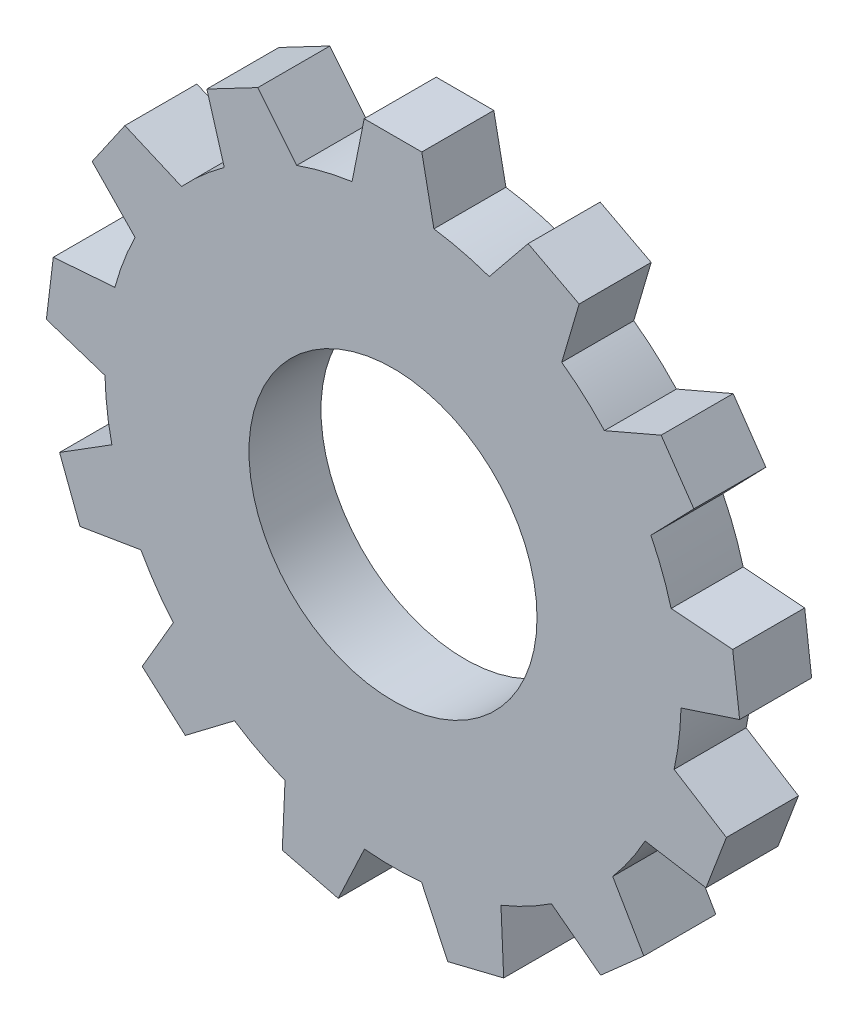
from build123d import *

# Parameters (mm, degrees)
SKETCH1_R           = 12.7
SKETCH1_R_2         = 6.35
BOSS_EXTRUDE1_DEPTH = 3.175
BOSS_EXTRUDE2_DEPTH = 3.175
CIRPATTERN1_COUNT   = 13


with BuildPart() as part:
    # Sketch1 → Boss-Extrude1 (new body)
    with BuildSketch(Plane.XY):
        Circle(SKETCH1_R)
        Circle(SKETCH1_R_2, mode=Mode.SUBTRACT)
    extrude(amount=BOSS_EXTRUDE1_DEPTH)

    # Sketch2 → Boss-Extrude2 (add)
    with BuildSketch(Plane.XY):
        Polygon((-1.27, 15.24), (1.27, 15.24), (1.905, 12.065), (-1.905, 12.065), align=None)
    boss_extrude2 = extrude(amount=BOSS_EXTRUDE2_DEPTH)

    # CirPattern1: Boss-Extrude2 ×13 about axis
    cirpattern1_axis = Axis((0, 0, 0), (0, 0, 1))
    for i in range(1, CIRPATTERN1_COUNT):
        add(boss_extrude2.rotate(cirpattern1_axis, i * 360 / CIRPATTERN1_COUNT))


solid = part.part
